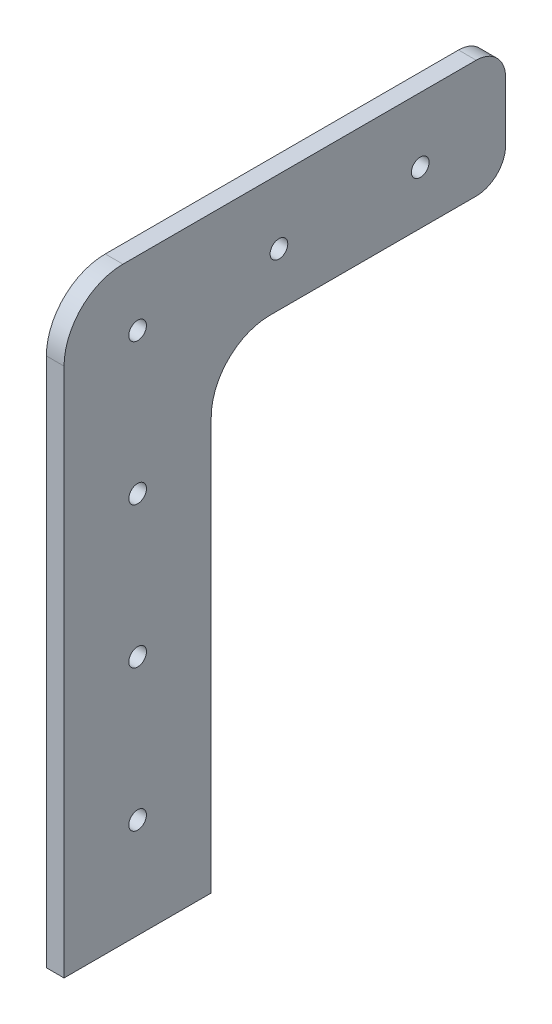
from build123d import *

# Parameters (mm, degrees)
CROQUIS1_W              = 75
CROQUIS1_H              = 100
SALIENTE_EXTRUIR1_DEPTH = 3
CROQUIS2_W              = 50
CROQUIS2_H              = 80
CORTAR_EXTRUIR1_DEPTH   = 3
REDONDEO1_R             = 10
REDONDEO3_R             = 5
CROQUIS3_R              = 1.5
CORTAR_EXTRUIR2_DEPTH   = 3


with BuildPart() as part:
    # Croquis1 → Saliente-Extruir1 (new body)
    with BuildSketch(Plane(origin=(0, 0, 0), x_dir=(0, 0, -1), z_dir=(1, 0, 0))):
        with Locations((37.5, -50)):
            Rectangle(CROQUIS1_W, CROQUIS1_H)
    extrude(amount=SALIENTE_EXTRUIR1_DEPTH)

    # Croquis2 → Cortar-Extruir1 (cut)
    with BuildSketch(Plane(origin=(3, 0, 0), x_dir=(0, 0, -1), z_dir=(1, 0, 0))):
        with Locations((50, -60)):
            Rectangle(CROQUIS2_W, CROQUIS2_H)
    extrude(amount=-CORTAR_EXTRUIR1_DEPTH, mode=Mode.SUBTRACT)

    # Redondeo1
    redondeo1_edges = [part.edges().sort_by_distance(p)[0] for p in [
        (1.5, -20, -25),
        (1.5, 0, 0),
    ]]
    fillet(redondeo1_edges, radius=REDONDEO1_R)

    # Redondeo3
    redondeo3_edges = [part.edges().sort_by_distance(p)[0] for p in [
        (1.5, -20, -75),
        (1.5, 0, -75),
    ]]
    fillet(redondeo3_edges, radius=REDONDEO3_R)

    # Croquis3 → Cortar-Extruir2 (cut)
    with BuildSketch(Plane(origin=(3, 0, 0), x_dir=(0, 0, -1), z_dir=(1, 0, 0))):
        with Locations((12.5, -11)):
            Circle(CROQUIS3_R)
        with Locations((12.5, -59)):
            Circle(CROQUIS3_R)
        with Locations((12.5, -83)):
            Circle(CROQUIS3_R)
        with Locations((12.5, -35)):
            Circle(CROQUIS3_R)
        with Locations((36.5, -11)):
            Circle(CROQUIS3_R)
        with Locations((60.5, -11)):
            Circle(CROQUIS3_R)
    extrude(amount=-CORTAR_EXTRUIR2_DEPTH, mode=Mode.SUBTRACT)


solid = part.part
